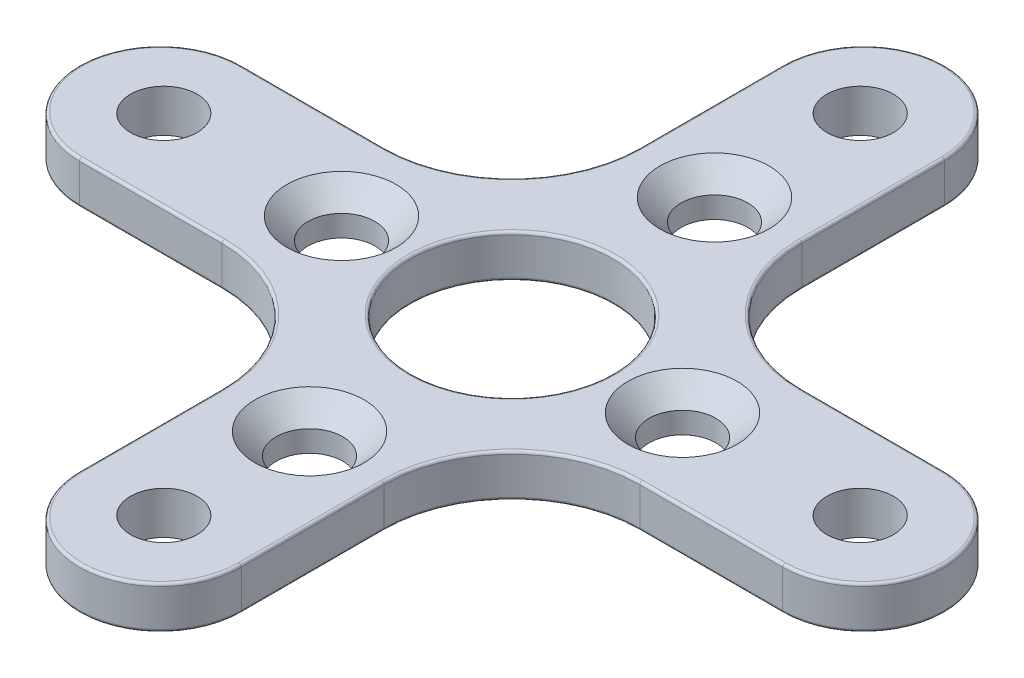
from build123d import *

# Parameters (mm, degrees)
SKETCH1_R             = 1.5625
BOSS_EXTRUDE1_DEPTH   = 2
CIRPATTERN1_COUNT     = 2
CIRPATTERN1_ANGLE     = 90
SKETCH2_R             = 1.5625
CUT_EXTRUDE1_DEPTH    = 2
CHAMFER1_SIZE         = 1
REDONDEO1_R           = 6
CROQUIS1_R            = 4.75
CORTAR_EXTRUIR1_DEPTH = 10
FILLET1_R             = 0.125


with BuildPart() as part:
    # Sketch1 → Boss-Extrude1 (new body)
    with BuildSketch(Plane(origin=(0, 0, 0), x_dir=(1, 0, 0), z_dir=(0, 1, 0))):
        with BuildLine():
            Line((-3.8, -16.5), (-3.8, 16.5))
            ThreePointArc((-3.8, 16.5), (0, 20.3), (3.8, 16.5))
            Line((3.8, 16.5), (3.8, -16.5))
            ThreePointArc((3.8, -16.5), (0, -20.3), (-3.8, -16.5))
        make_face()
        with Locations(Location((0, 16.3375, 0), (0, 0, 270))):
            Circle(SKETCH1_R, mode=Mode.SUBTRACT)
        with Locations(Location((0, -16.3375, 0), (0, 0, 90))):
            Circle(SKETCH1_R, mode=Mode.SUBTRACT)
    boss_extrude1 = extrude(amount=BOSS_EXTRUDE1_DEPTH)

    # CirPattern1: Boss-Extrude1 ×2 about axis
    cirpattern1_axis = Axis((0, 0, 0), (0, 1, 0))
    for i in range(1, CIRPATTERN1_COUNT):
        add(boss_extrude1.rotate(cirpattern1_axis, i * CIRPATTERN1_ANGLE / (CIRPATTERN1_COUNT - 1)))

    # Sketch2 → Cut-Extrude1 (cut)
    with BuildSketch(Plane(origin=(0, 0, 0), x_dir=(1, 0, 0), z_dir=(0, 1, 0))):
        with Locations(Location((0, 9.5, 0), (0, 0, 270))):
            Circle(SKETCH2_R)
        with Locations(Location((8, 0, 0), (0, 0, 270))):
            Circle(SKETCH2_R)
        with Locations(Location((0, -9.5, 0), (0, 0, 90))):
            Circle(SKETCH2_R)
        with Locations(Location((-8, 0, 0), (0, 0, 90))):
            Circle(SKETCH2_R)
    extrude(amount=CUT_EXTRUDE1_DEPTH, mode=Mode.SUBTRACT)

    # Chamfer1
    chamfer1_edges = [part.edges().sort_by_distance(p)[0] for p in [
        (0, 2, -11.0625),
        (8, 2, -1.5625),
        (0, 2, 11.0625),
        (-8, 2, 1.5625),
    ]]
    chamfer(chamfer1_edges, length=CHAMFER1_SIZE)

    # Redondeo1
    redondeo1_edges = [part.edges().sort_by_distance(p)[0] for p in [
        (-3.8, 1, 3.8),
        (-3.8, 1, -3.8),
        (3.8, 1, -3.8),
        (3.8, 1, 3.8),
    ]]
    fillet(redondeo1_edges, radius=REDONDEO1_R)

    # Croquis1 → Cortar-Extruir1 (cut)
    with BuildSketch(Plane(origin=(0, 2, 0), x_dir=(1, 0, 0), z_dir=(0, 1, 0))):
        with Locations(Location((0, 0, 0), (0, 0, 270))):
            Circle(CROQUIS1_R)
    extrude(amount=-CORTAR_EXTRUIR1_DEPTH, mode=Mode.SUBTRACT)

    # Fillet1
    fillet1_edges = [part.edges().sort_by_distance(p)[0] for p in [
        (0, 2, -20.3),
        (0, 0, -4.75),
        (0, 2, -4.75),
        (-3.8, 2, -13.15),
        (20.3, 2, 0),
        (13.15, 2, -3.8),
        (-20.3, 2, 0),
        (-13.15, 2, 3.8),
        (13.15, 0, -3.8),
        (-13.15, 0, 3.8),
        (20.3, 0, 0),
        (-20.3, 0, 0),
        (0, 2, 20.3),
        (-3.8, 0, -13.15),
        (0, 0, -20.3),
        (3.8, 0, 13.15),
        (0, 0, 20.3),
        (3.8, 2, 13.15),
        (-13.15, 2, -3.8),
        (-13.15, 0, -3.8),
        (-3.8, 0, 13.15),
        (-3.8, 2, 13.15),
        (13.15, 2, 3.8),
        (13.15, 0, 3.8),
        (3.8, 0, -13.15),
        (3.8, 2, -13.15),
        (-5.557359313, 0, -5.557359313),
        (-5.557359313, 2, -5.557359313),
        (-5.557359313, 2, 5.557359313),
        (-5.557359313, 0, 5.557359313),
        (5.557359313, 0, 5.557359313),
        (5.557359313, 2, 5.557359313),
        (5.557359313, 2, -5.557359313),
        (5.557359313, 0, -5.557359313),
    ]]
    fillet(fillet1_edges, radius=FILLET1_R)


solid = part.part
